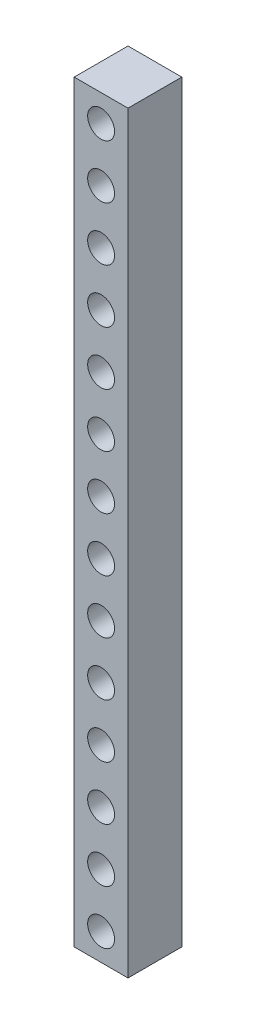
from build123d import *

# Parameters (mm, degrees)
ESQUISSE1_W = 10
ESQUISSE1_H = 140
ESQUISSE1_R = 2.5
BASE_DEPTH  = 10


with BuildPart() as part:
    # Esquisse1 → BASE (new body)
    with BuildSketch(Plane.XY):
        Rectangle(ESQUISSE1_W, ESQUISSE1_H)
        with Locations((0, 65)):
            Circle(ESQUISSE1_R, mode=Mode.SUBTRACT)
        with Locations((0, 55)):
            Circle(ESQUISSE1_R, mode=Mode.SUBTRACT)
        with Locations((0, 45)):
            Circle(ESQUISSE1_R, mode=Mode.SUBTRACT)
        with Locations((0, 35)):
            Circle(ESQUISSE1_R, mode=Mode.SUBTRACT)
        with Locations((0, 25)):
            Circle(ESQUISSE1_R, mode=Mode.SUBTRACT)
        with Locations((0, 15)):
            Circle(ESQUISSE1_R, mode=Mode.SUBTRACT)
        with Locations((0, 5)):
            Circle(ESQUISSE1_R, mode=Mode.SUBTRACT)
        with Locations((0, -5)):
            Circle(ESQUISSE1_R, mode=Mode.SUBTRACT)
        with Locations((0, -15)):
            Circle(ESQUISSE1_R, mode=Mode.SUBTRACT)
        with Locations((0, -25)):
            Circle(ESQUISSE1_R, mode=Mode.SUBTRACT)
        with Locations((0, -35)):
            Circle(ESQUISSE1_R, mode=Mode.SUBTRACT)
        with Locations((0, -45)):
            Circle(ESQUISSE1_R, mode=Mode.SUBTRACT)
        with Locations((0, -55)):
            Circle(ESQUISSE1_R, mode=Mode.SUBTRACT)
        with Locations((0, -65)):
            Circle(ESQUISSE1_R, mode=Mode.SUBTRACT)
    extrude(amount=BASE_DEPTH)


solid = part.part
